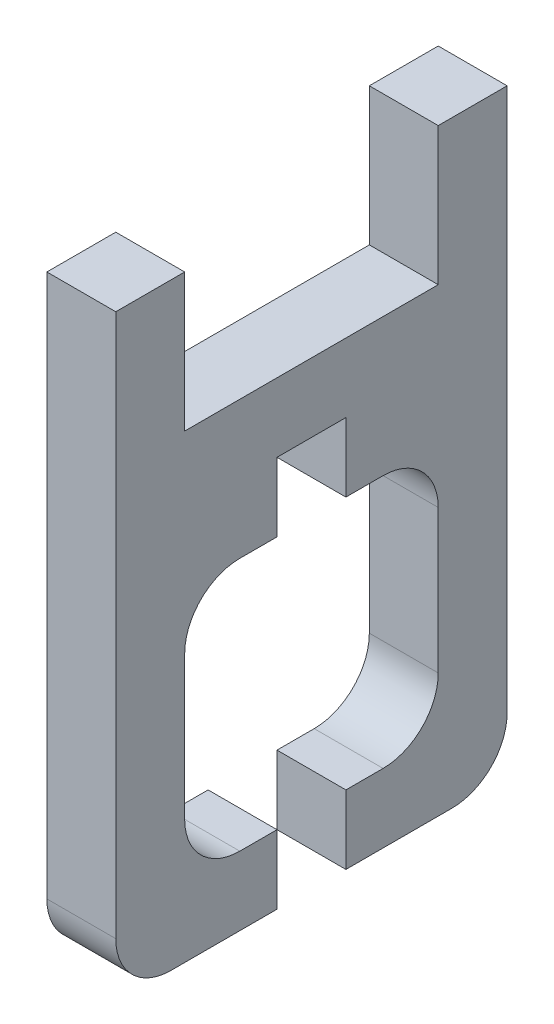
from build123d import *

# Parameters (mm, degrees)
BOSS_EXTRUDE1_DEPTH = 6.35


with BuildPart() as part:
    # Sketch2 → Boss-Extrude1 (new body)
    with BuildSketch(Plane(origin=(0, 0, 0), x_dir=(0, 0, -1), z_dir=(1, 0, 0))):
        with BuildLine():
            Line((21.209, 0), (30.988, 0))
            ThreePointArc((30.988, 0), (34.580102448, 1.487897552), (36.068, 5.08))
            Line((36.068, 5.08), (36.068, 36.068))
            Line((36.068, 36.068), (36.068, 55.118))
            Line((36.068, 55.118), (29.718, 55.118))
            Line((29.718, 55.118), (29.718, 42.418))
            Line((29.718, 42.418), (6.35, 42.418))
            Line((6.35, 42.418), (6.35, 55.118))
            Line((6.35, 55.118), (0, 55.118))
            Line((0, 55.118), (0, 36.068))
            Line((0, 36.068), (0, 5.08))
            ThreePointArc((0, 5.08), (1.487897552, 1.487897552), (5.08, 0))
            Line((5.08, 0), (14.859, 0))
            Line((14.859, 0), (14.859, 6.35))
            Line((14.859, 6.35), (11.43, 6.35))
            ThreePointArc((11.43, 6.35), (7.837897552, 7.837897552), (6.35, 11.43))
            Line((6.35, 11.43), (6.35, 24.638))
            ThreePointArc((6.35, 24.638), (7.837897552, 28.230102448), (11.43, 29.718))
            Line((11.43, 29.718), (14.859, 29.718))
            Line((14.859, 29.718), (14.859, 36.068))
            Line((14.859, 36.068), (21.209, 36.068))
            Line((21.209, 36.068), (21.209, 29.718))
            Line((21.209, 29.718), (24.638, 29.718))
            ThreePointArc((24.638, 29.718), (28.230102448, 28.230102448), (29.718, 24.638))
            Line((29.718, 24.638), (29.718, 11.43))
            ThreePointArc((29.718, 11.43), (28.230102448, 7.837897552), (24.638, 6.35))
            Line((24.638, 6.35), (21.209, 6.35))
            Line((21.209, 6.35), (21.209, 0))
        make_face()
    extrude(amount=BOSS_EXTRUDE1_DEPTH)


solid = part.part
